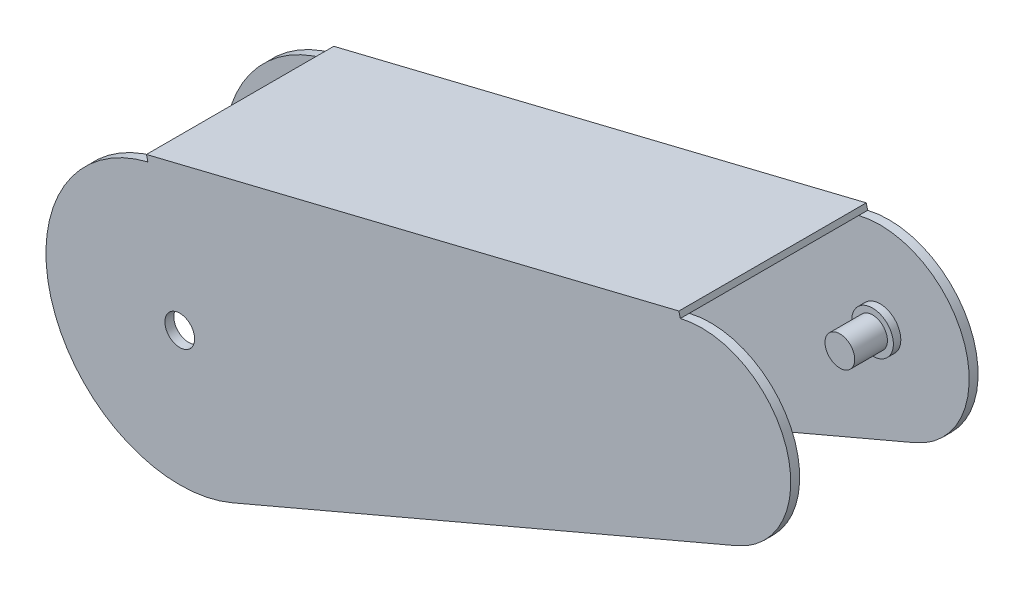
from build123d import *

# Parameters (mm, degrees)
SKETCH1_R           = 45
SKETCH1_R_2         = 5
SKETCH1_R_3         = 30
BOSS_EXTRUDE1_DEPTH = 3
SKETCH2_W           = 184.390889146
SKETCH2_H           = 63
BOSS_EXTRUDE2_DEPTH = 2
BOSS_EXTRUDE3_START = -3
SKETCH3_R           = 45
SKETCH3_R_2         = 5
SKETCH3_R_3         = 30
BOSS_EXTRUDE3_DEPTH = 3
SKETCH5_R           = 7
SKETCH5_R_2         = 5
BOSS_EXTRUDE4_DEPTH = 2.5
BOSS_EXTRUDE5_START = 2.5
SKETCH7_R           = 7
SKETCH7_R_2         = 5
BOSS_EXTRUDE5_DEPTH = 2.5
SKETCH11_R          = 5
BOSS_EXTRUDE6_DEPTH = 5.5
BOSS_EXTRUDE7_START = 10
SKETCH12_R          = 5
BOSS_EXTRUDE7_DEPTH = 10
SKETCH13_R          = 5
BOSS_EXTRUDE8_DEPTH = 16.5
BOSS_EXTRUDE9_START = 5
BOSS_EXTRUDE9_DEPTH = 5


with BuildPart() as part:
    # Sketch1 → Boss-Extrude1 (new body)
    # profile 1 of 3: a face of its own
    with BuildSketch(Plane.XY):
        with BuildLine():
            Line((88.102445193, 65.890888235), (-90.975875137, 21.948253042))
            ThreePointArc((-90.975875137, 21.948253042), (-52.481172674, 13.65368388), (-35.251817171, -21.755231724))
            ThreePointArc((-35.251817171, -21.755231724), (-42.707811228, -46.563448464), (-62.605044629, -63.150780021))
            Line((-62.605044629, -63.150780021), (107.016332199, 9.158199526))
            ThreePointArc((107.016332199, 9.158199526), (66.791768359, 27.267048462), (88.102445193, 65.890888235))
        make_face()
    # profile 2 of 3: a face of its own
    with BuildSketch(Plane.XY):
        with Locations((-80.251817171, -21.755231724)):
            Circle(SKETCH1_R)
        with Locations((-80.251817171, -21.755231724)):
            Circle(SKETCH1_R_2, mode=Mode.SUBTRACT)
    # profile 3 of 3: a face of its own
    with BuildSketch(Plane.XY):
        with Locations((95.251817171, 36.755231724)):
            Circle(SKETCH1_R_3)
        with Locations((95.251817171, 36.755231724)):
            Circle(SKETCH1_R_2, mode=Mode.SUBTRACT)
    extrude(amount=BOSS_EXTRUDE1_DEPTH)

    # Sketch2 → Boss-Extrude2 (add)
    with BuildSketch(Plane(origin=(-10.246616026, 41.75777759, 0), x_dir=(0.971188550366469, 0.23831239925164718, 0), z_dir=(-0.23831239925164718, 0.971188550366469, 0))):
        with Locations((9.071257122, -31.5)):
            Rectangle(SKETCH2_W, SKETCH2_H)
    extrude(amount=BOSS_EXTRUDE2_DEPTH)

    # Sketch3 → Boss-Extrude3 (add)
    # profile 1 of 3: a face of its own
    with BuildSketch(Plane.XY.offset(63).offset(BOSS_EXTRUDE3_START)):
        with Locations((-80.251817171, -21.755231724)):
            Circle(SKETCH3_R)
        with Locations((-80.251817171, -21.755231724)):
            Circle(SKETCH3_R_2, mode=Mode.SUBTRACT)
    # profile 2 of 3: a face of its own
    with BuildSketch(Plane.XY.offset(63).offset(BOSS_EXTRUDE3_START)):
        with BuildLine():
            ThreePointArc((-35.251817171, -21.755231724), (-42.707811228, -46.563448464), (-62.605044629, -63.150780021))
            Line((-62.605044629, -63.150780021), (107.016332199, 9.158199526))
            ThreePointArc((107.016332199, 9.158199526), (66.791768359, 27.267048462), (88.102445193, 65.890888235))
            Line((88.102445193, 65.890888235), (-90.975875137, 21.948253042))
            ThreePointArc((-90.975875137, 21.948253042), (-52.481172674, 13.65368388), (-35.251817171, -21.755231724))
        make_face()
    # profile 3 of 3: a face of its own
    with BuildSketch(Plane.XY.offset(63).offset(BOSS_EXTRUDE3_START)):
        with Locations((95.251817171, 36.755231724)):
            Circle(SKETCH3_R_3)
        with Locations((95.251817171, 36.755231724)):
            Circle(SKETCH3_R_2, mode=Mode.SUBTRACT)
    extrude(amount=BOSS_EXTRUDE3_DEPTH)

    # Sketch5 → Boss-Extrude4 (add)
    with BuildSketch(Plane.XY.offset(3)):
        with Locations((95.251817171, 36.755231724)):
            Circle(SKETCH5_R)
        with Locations((95.251817171, 36.755231724)):
            Circle(SKETCH5_R_2, mode=Mode.SUBTRACT)
    extrude(amount=BOSS_EXTRUDE4_DEPTH)

    # Sketch7 → Boss-Extrude5 (add)
    with BuildSketch(Plane(origin=(0, 0, 60), x_dir=(-1, 0, 0), z_dir=(0, 0, -1)).offset(BOSS_EXTRUDE5_START)):
        with Locations(Location((-95.251817171, 36.755231724, 0), (0, 0, 180))):
            Circle(SKETCH7_R)
        with Locations(Location((-95.251817171, 36.755231724, 0), (0, 0, 180))):
            Circle(SKETCH7_R_2, mode=Mode.SUBTRACT)
    extrude(amount=-BOSS_EXTRUDE5_DEPTH)

    # Sketch11 → Boss-Extrude6 (add)
    with BuildSketch(Plane(origin=(0, 0, 57.5), x_dir=(-1, 0, 0), z_dir=(0, 0, -1))):
        with Locations(Location((-95.251817171, 36.755231724, 0), (0, 0, 180))):
            Circle(SKETCH11_R)
    extrude(amount=-BOSS_EXTRUDE6_DEPTH)

    # Sketch12 → Boss-Extrude7 (add)
    with BuildSketch(Plane(origin=(0, 0, 57.5), x_dir=(-1, 0, 0), z_dir=(0, 0, -1)).offset(BOSS_EXTRUDE7_START)):
        with Locations(Location((-95.251817171, 36.755231724, 0), (0, 0, 180))):
            Circle(SKETCH12_R)
    extrude(amount=-BOSS_EXTRUDE7_DEPTH)

    # Sketch13 → Boss-Extrude8 (add)
    with BuildSketch(Plane(origin=(0, 0, 0), x_dir=(-1, 0, 0), z_dir=(0, 0, -1))):
        with Locations((-95.251817171, 36.755231724)):
            Circle(SKETCH13_R)
    extrude(amount=-BOSS_EXTRUDE8_DEPTH)

    # Sketch15 → Boss-Extrude9 (add)
    with BuildSketch(Plane(origin=(0, 0, 60), x_dir=(-1, 0, 0), z_dir=(0, 0, -1)).offset(BOSS_EXTRUDE9_START)):
        with BuildLine():
            ThreePointArc((-88.353478337, 35.566568046), (-88.462927218, 35.049074286), (-88.611139115, 34.541322296))
            Line((-88.611139115, 34.541322296), (75.508475702, -20.173867847))
            ThreePointArc((75.508475702, -20.173867847), (75.702840867, -19.679945097), (75.94847072, -19.20940979))
            Line((75.94847072, -19.20940979), (-88.353478337, 35.566568046))
        make_face()
    extrude(amount=-BOSS_EXTRUDE9_DEPTH)


solid = part.part
